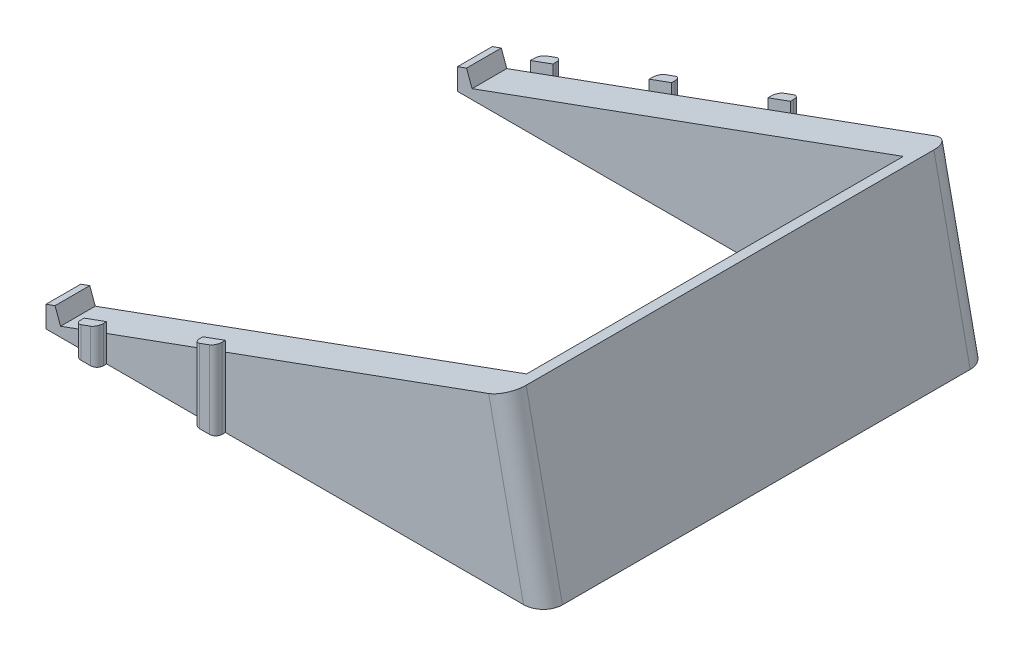
from build123d import *

# Parameters (mm, degrees)
BOSS_EXTRUDE1_DEPTH     = 100
TENT_ANGLE_OUTSIDE_W    = 224.378
TENT_ANGLE_OUTSIDE_H    = 151.378
CUT_EXTRUDE1_DEPTH      = 139
CUT_EXTRUDE3_DEPTH      = 200
FILLET1_R               = 6
FILLET2_R               = 6
FEET_INSET_R            = 4.25
CUT_EXTRUDE4_DEPTH      = 0.6
FILLET3_R               = 2
CUT_EXTRUDE5_DEPTH      = 40
CUT_EXTRUDE5_DEPTH_BACK = 200


with BuildPart() as part:
    # base-outline → Boss-Extrude1 (new body)
    with BuildSketch(Plane(origin=(0, 0, 0), x_dir=(1, 0, 0), z_dir=(0, 1, 0))):
        Polygon((0, 10.82), (0, 0), (30, 0), (30, -3), (37, -3), (37, 0), (67, 0), (67, -3), (74, -3), (74, 0), (111, 0), (173, 0), (173, 139), (111, 139), (111, 142), (104, 142), (104, 139), (74, 139), (74, 142), (67, 142), (67, 139), (37, 139), (37, 142), (30, 142), (30, 139), (0, 139), (0, 128.18), (157, 128.18), (157, 10.82), align=None)
    extrude(amount=BOSS_EXTRUDE1_DEPTH)

    # tent-angle outside → Cut-Extrude1 (cut)
    with BuildSketch(Plane.XY):
        with Locations((86.5, 50)):
            Rectangle(TENT_ANGLE_OUTSIDE_W, TENT_ANGLE_OUTSIDE_H)
        Polygon((173, 57.723222932), (22.649180674, 3), (20.939079958, 7.698463104), (18.120002095, 6.672402674), (18.120002095, 0), (22.649180674, 0), (173, 0), align=None, mode=Mode.SUBTRACT)
    extrude(amount=-CUT_EXTRUDE1_DEPTH, mode=Mode.SUBTRACT)

    # middle-angle → Cut-Extrude3 (cut)
    with BuildSketch(Plane.XY):
        Polygon((161.698463104, 53.6097999), (173, 0), (173, 57.723222932), align=None)
    extrude(amount=-CUT_EXTRUDE3_DEPTH, mode=Mode.SUBTRACT)

    # Fillet1
    fillet1_edges = [part.edges().sort_by_distance(p)[0] for p in [
        (167.349231552, 26.80489995, 0),
    ]]
    fillet(fillet1_edges, radius=FILLET1_R)

    # Fillet2
    fillet2_edges = [part.edges().sort_by_distance(p)[0] for p in [
        (167.349231552, 26.80489995, -139),
    ]]
    fillet(fillet2_edges, radius=FILLET2_R)

    # feet-inset → Cut-Extrude4 (cut)
    with BuildSketch(Plane.XZ):
        with Locations(Location((45, -5.32, 0), (0, 0, 270))):
            Circle(FEET_INSET_R)
        with Locations(Location((165, -5.32, 0), (0, 0, 270))):
            Circle(FEET_INSET_R)
        with Locations(Location((165, -133.68, 0), (0, 0, 270))):
            Circle(FEET_INSET_R)
        with Locations(Location((45, -133.68, 0), (0, 0, 270))):
            Circle(FEET_INSET_R)
    extrude(amount=-CUT_EXTRUDE4_DEPTH, mode=Mode.SUBTRACT)

    # Fillet3
    fillet3_edges = [part.edges().sort_by_distance(p)[0] for p in [
        (104, 50, -142),
        (111, 50, -142),
        (74, 50, 3),
        (67, 50, 3),
        (37, 50, 3),
        (30, 50, 3),
        (30, 50, -142),
        (37, 50, -142),
        (67, 50, -142),
        (74, 50, -142),
    ]]
    fillet(fillet3_edges, radius=FILLET3_R)

    # keyboard-seat → Cut-Extrude5 (cut, two sides: drawn at the far end of the back side and taken through both)
    with BuildSketch(Plane.XY.offset(-CUT_EXTRUDE5_DEPTH_BACK)):
        Polygon((126.470388341, 150.398139841), (160.672402674, 56.428877763), (21.623120244, 5.819077862), (-12.578894088, 99.788339941), align=None)
    extrude(amount=CUT_EXTRUDE5_DEPTH + CUT_EXTRUDE5_DEPTH_BACK, mode=Mode.SUBTRACT)


solid = part.part
